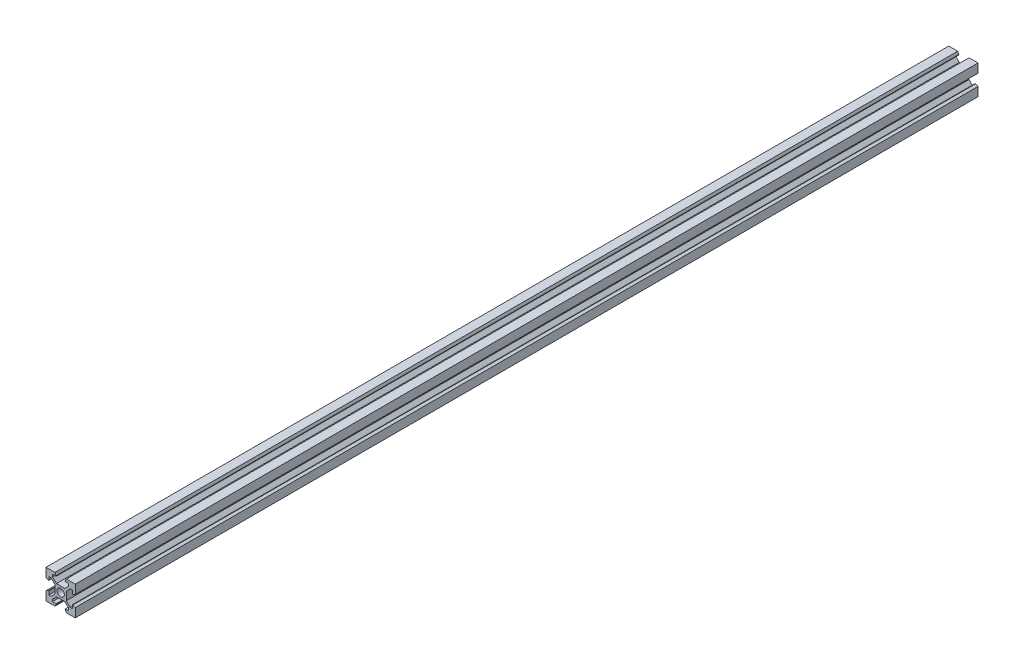
from build123d import *

# Parameters (mm, degrees)
SKETCH1_R           = 2.5
BOSS_EXTRUDE1_DEPTH = 617.1


with BuildPart() as part:
    # Sketch1 → Boss-Extrude1 (new body)
    with BuildSketch(Plane.XY):
        Polygon((6.1, 20), (0, 20), (0, 13.895792909), (1.56, 13.1), (1.9, 13.1), (1.9, 15.5), (3.439339828, 15.5), (6.1, 12.839339828), (6.1, 7.160660172), (3.439339828, 4.5), (1.9, 4.5), (1.9, 6.9), (1.56, 6.9), (0, 6.104207091), (0, 0), (6.1, 0), (6.9, 1.56), (6.9, 1.9), (4.5, 1.9), (4.5, 3.439339828), (7.160660172, 6.1), (12.839339828, 6.1), (15.5, 3.439339828), (15.5, 1.9), (13.1, 1.9), (13.1, 1.56), (13.9, 0), (20, 0), (20, 6.104207091), (18.44, 6.9), (18.1, 6.9), (18.1, 4.5), (16.560660172, 4.5), (13.9, 7.160660172), (13.9, 12.839339828), (16.560660172, 15.5), (18.1, 15.5), (18.1, 13.1), (18.44, 13.1), (20, 13.895792909), (20, 20), (13.9, 20), (13.1, 18.44), (13.1, 18.1), (15.5, 18.1), (15.5, 16.560660172), (12.839339828, 13.9), (7.160660172, 13.9), (4.5, 16.560660172), (4.5, 18.1), (6.9, 18.1), (6.9, 18.44), align=None)
        with Locations((10, 10)):
            Circle(SKETCH1_R, mode=Mode.SUBTRACT)
    extrude(amount=BOSS_EXTRUDE1_DEPTH)


solid = part.part
